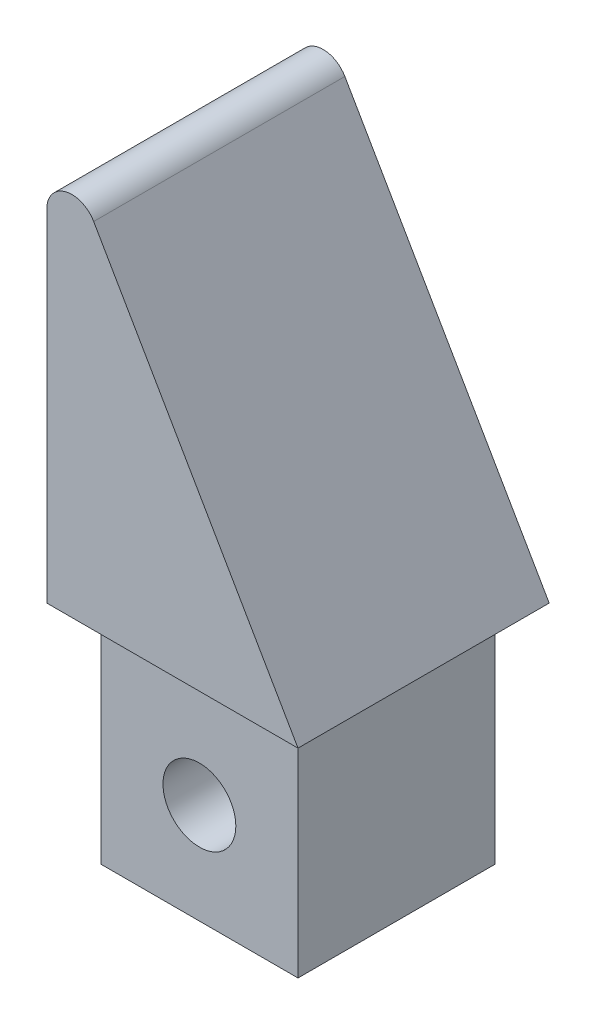
from build123d import *

# Parameters (mm, degrees)
SKETCH_1_W          = 7.85
SKETCH_1_H          = 7.85
EXTRUDE_1_DEPTH     = 10
SKETCH_2_W          = 10
SKETCH_2_H          = 10
EXTRUDE_2_DEPTH     = 30
CUT_EXTRUDE_1_DEPTH = 30
FILLET_1_R          = 1
CHAMFER_1_SIZE      = 1
SKETCH_4_R          = 1.45
CUT_EXTRUDE_2_DEPTH = 30


with BuildPart() as part:
    # ｽｹｯﾁ1 → ﾎﾞｽ - 押し出し1 (new body)
    with BuildSketch(Plane(origin=(0, 0, 0), x_dir=(1, 0, 0), z_dir=(0, 1, 0))):
        Rectangle(SKETCH_1_W, SKETCH_1_H)
    extrude(amount=EXTRUDE_1_DEPTH)

    # ｽｹｯﾁ2 → ﾎﾞｽ - 押し出し2 (add)
    with BuildSketch(Plane(origin=(0, 10, 0), x_dir=(1, 0, 0), z_dir=(0, 1, 0))):
        Rectangle(SKETCH_2_W, SKETCH_2_H)
    extrude(amount=EXTRUDE_2_DEPTH)

    # ｽｹｯﾁ3 → ｶｯﾄ - 押し出し1 (cut)
    with BuildSketch(Plane.XY.offset(5)):
        Polygon((-5, 27.320508076), (5, 10), (5, 40), (-5, 40), align=None)
    extrude(amount=-CUT_EXTRUDE_1_DEPTH, mode=Mode.SUBTRACT)

    # ﾌｨﾚｯﾄ1
    fillet_1_edges = [part.edges().sort_by_distance(p)[0] for p in [
        (-5, 27.320508076, 0),
    ]]
    fillet(fillet_1_edges, radius=FILLET_1_R)

    # 面取り1
    chamfer_1_edges = [part.edges().sort_by_distance(p)[0] for p in [
        (0, 0, 3.925),
        (-3.925, 0, 0),
        (0, 0, -3.925),
        (3.925, 0, 0),
    ]]
    chamfer(chamfer_1_edges, length=CHAMFER_1_SIZE)

    # ｽｹｯﾁ4 → ｶｯﾄ - 押し出し2 (cut)
    with BuildSketch(Plane.XY.offset(3.925)):
        with Locations((0, 5)):
            Circle(SKETCH_4_R)
    extrude(amount=-CUT_EXTRUDE_2_DEPTH, mode=Mode.SUBTRACT)


solid = part.part
